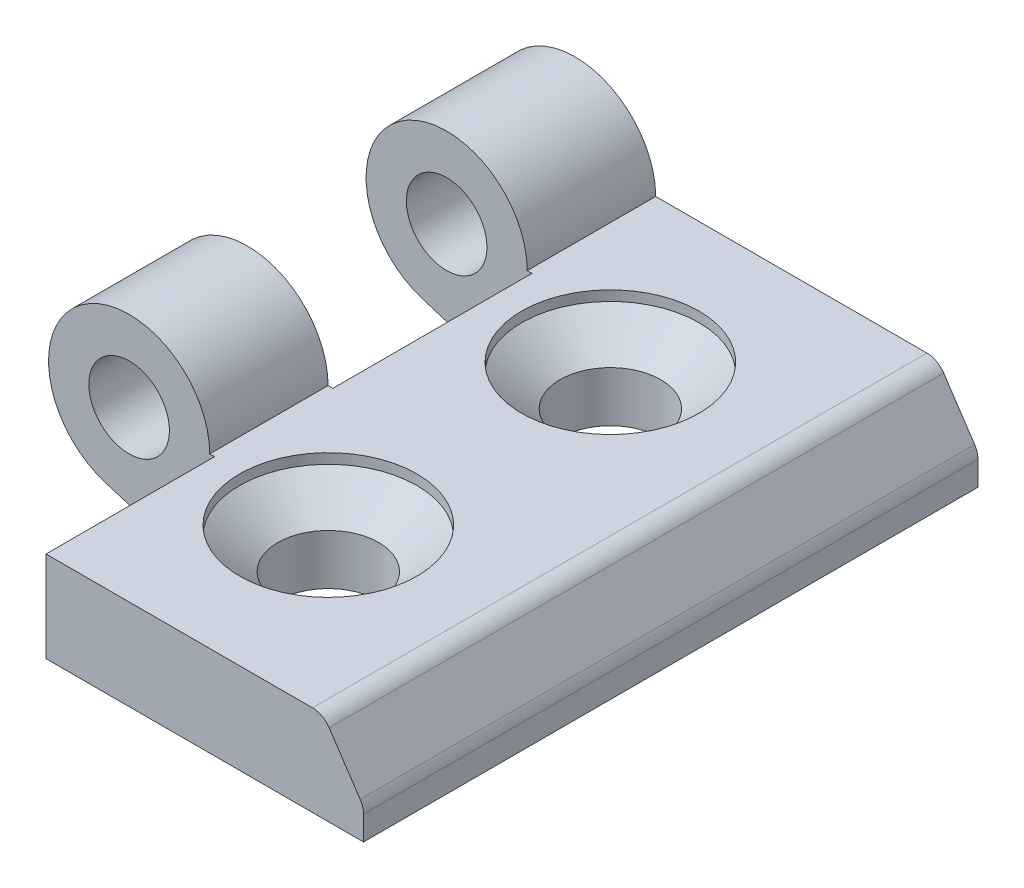
from build123d import *

# Parameters (mm, degrees)
EXTRUDE_1_DEPTH          = 15.25
CUT_EXTRUDE_1_DEPTH      = 26.550195694
CUT_EXTRUDE_1_DEPTH_BACK = 26.550195694
SKETCH_3_W               = 8.238165393
SKETCH_3_H               = 8.365
SKETCH_3_H_2             = 9.885
SKETCH_4_R               = 2
CUT_EXTRUDE_2_DEPTH      = 31.169657356
PATTERN_LINEAR_1_COUNT   = 2
PATTERN_LINEAR_1_PITCH   = 14


with BuildPart() as part:
    # 草图1 → 凸台-拉伸1 (new, symmetric)
    with BuildSketch(Plane.XY):
        with BuildLine():
            Line((17.464816242, 0), (4, 0))
            ThreePointArc((4, 0), (-2.371533507, 3.221153338), (-1.187914412, -3.819536536))
            Line((-1.187914412, -3.819536536), (1, -4.5))
            Line((1, -4.5), (20, -4.5))
            Line((20, -4.5), (20, -3.302775638))
            ThreePointArc((20, -3.302775638), (19.957092026, -3.012991489), (19.832050294, -2.748075442))
            Line((19.832050294, -2.748075442), (18.296866536, -0.445299804))
            ThreePointArc((18.296866536, -0.445299804), (17.936674167, -0.118325401), (17.464816242, 0))
        make_face()
    extrude(amount=EXTRUDE_1_DEPTH, both=True)

    # 草图3 → 切除-拉伸1 (cut, two sides: drawn at the far end of the back side and taken through both)
    with BuildSketch(Plane(origin=(0, 0, 0), x_dir=(1, 0, 0), z_dir=(0, 1, 0)).offset(-CUT_EXTRUDE_1_DEPTH_BACK)):
        with Locations((0.119082697, -11.0675)):
            Rectangle(SKETCH_3_W, SKETCH_3_H)
        with Locations((0.119082697, 3.9325)):
            Rectangle(SKETCH_3_W, SKETCH_3_H_2)
    extrude(amount=CUT_EXTRUDE_1_DEPTH + CUT_EXTRUDE_1_DEPTH_BACK, mode=Mode.SUBTRACT)

    # 草图4 → 切除-拉伸2 (cut, through all)
    with BuildSketch(Plane.XY.offset(6.885)):
        Circle(SKETCH_4_R)
    extrude(amount=-CUT_EXTRUDE_2_DEPTH, mode=Mode.SUBTRACT)

    # 草图5 → 切除-旋转1 (revolve, cut)
    with BuildSketch(Plane.XY.offset(7), mode=Mode.PRIVATE) as cut_revolve_1_sk:
        Polygon((10, -4.5), (10, 0), (14.4, 0), (14.4, -0.5), (12.5, -2), (12.5, -4.5), align=None)
    cut_revolve_1 = revolve(cut_revolve_1_sk.sketch.rotate(Axis((10, -4.5, 7), (0, 1, 0)), 90), axis=Axis((10, -4.5, 7), (0, 1, 0)), mode=Mode.SUBTRACT)

    # 阵列(线性)1: 切除-旋转1 ×2
    with Locations(*[(0, 0, -i * PATTERN_LINEAR_1_PITCH) for i in range(1, PATTERN_LINEAR_1_COUNT)]):
        add(cut_revolve_1, mode=Mode.SUBTRACT)


solid = part.part
